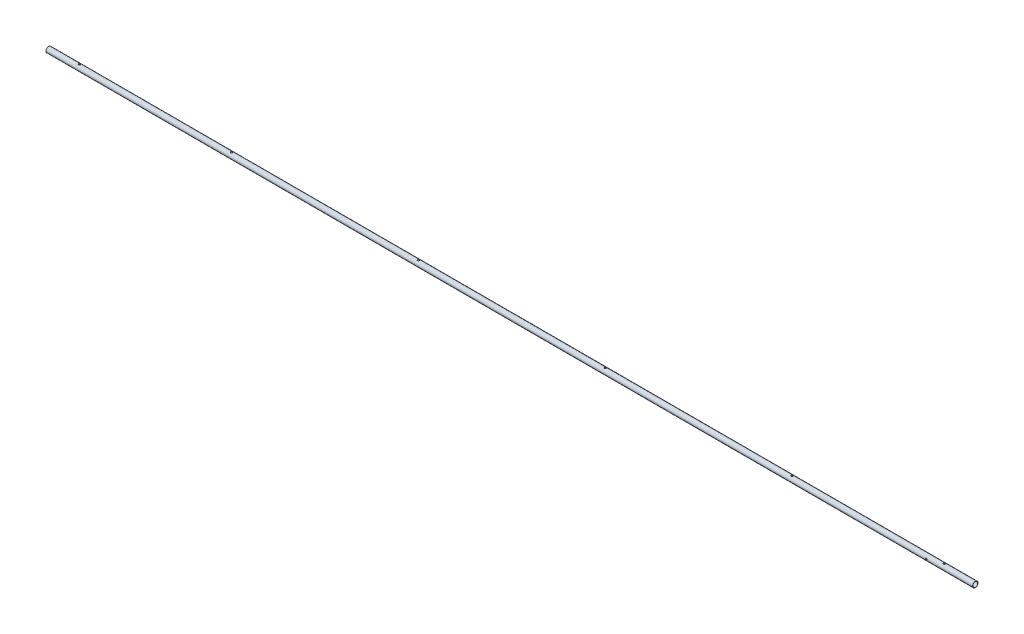
from build123d import *

# Parameters (mm, degrees)
SKETCH1_R               = 8.9662
SKETCH1_R_2             = 7.8994
BOSS_EXTRUDE1_DEPTH     = 3048
CUT_EXTRUDE5_DEPTH      = 3049.026375458
CUT_EXTRUDE5_DEPTH_BACK = 3049.026375458
SKETCH2_R               = 3.175
CUT_EXTRUDE6_DEPTH      = 3049.026375558
CUT_EXTRUDE6_DEPTH_BACK = 3049.026375558
SKETCH3_R               = 3.175


with BuildPart() as part:
    # Sketch1 → Boss-Extrude1 (new body)
    with BuildSketch(Plane(origin=(0, 0, 0), x_dir=(0, 0, -1), z_dir=(1, 0, 0))):
        Circle(SKETCH1_R)
        Circle(SKETCH1_R_2, mode=Mode.SUBTRACT)
    extrude(amount=BOSS_EXTRUDE1_DEPTH)

    # Sketch2 → Cut-Extrude5 (cut, two sides: drawn at the far end of the back side and taken through both)
    with BuildSketch(Plane(origin=(0, 0, 0), x_dir=(1, 0, 0), z_dir=(0, 1, 0)).offset(-CUT_EXTRUDE5_DEPTH_BACK)):
        with Locations(Location((601.98, 0, 0), (0, 0, 270))):
            Circle(SKETCH2_R)
        with Locations(Location((1216.66, 0, 0), (0, 0, 270))):
            Circle(SKETCH2_R)
        with Locations(Location((101.6, 0, 0), (0, 0, 270))):
            Circle(SKETCH2_R)
        with Locations(Location((2946.4, 0, 0), (0, 0, 270))):
            Circle(SKETCH2_R)
        with Locations(Location((2446.02, 0, 0), (0, 0, 270))):
            Circle(SKETCH2_R)
        with Locations(Location((1831.34, 0, 0), (0, 0, 270))):
            Circle(SKETCH2_R)
    extrude(amount=CUT_EXTRUDE5_DEPTH + CUT_EXTRUDE5_DEPTH_BACK, mode=Mode.SUBTRACT)

    # Sketch3 → Cut-Extrude6 (cut, two sides: drawn at the far end of the back side and taken through both)
    with BuildSketch(Plane.XY.offset(-CUT_EXTRUDE6_DEPTH_BACK)):
        with Locations((2895.6, 0)):
            Circle(SKETCH3_R)
    extrude(amount=CUT_EXTRUDE6_DEPTH + CUT_EXTRUDE6_DEPTH_BACK, mode=Mode.SUBTRACT)


solid = part.part
